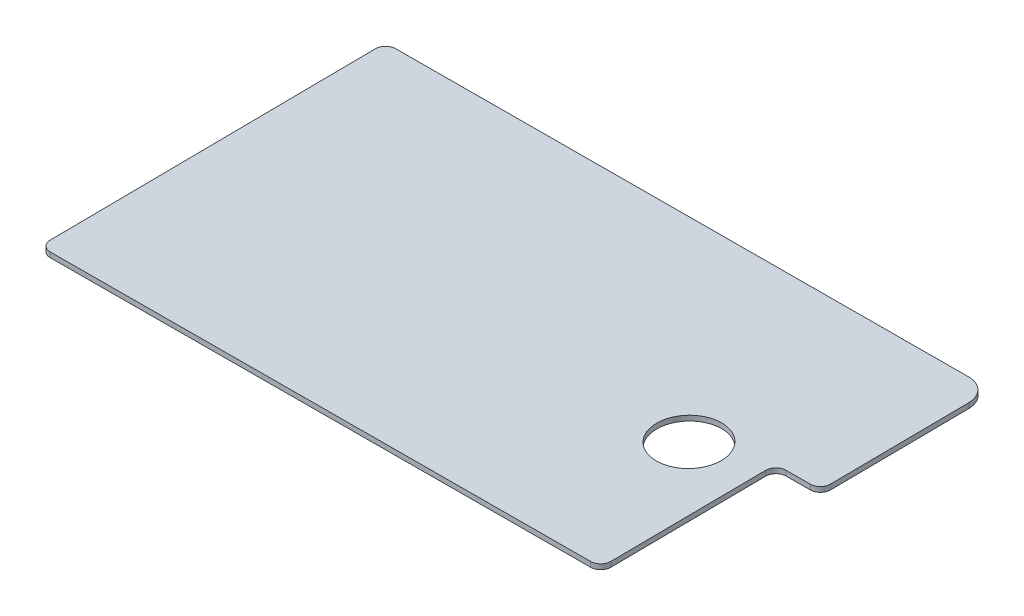
from build123d import *

# Parameters (mm, degrees)
BOSS_EXTRUDE1_DEPTH = 3.175
SKETCH4_R           = 20.32
CUT_EXTRUDE1_DEPTH  = 3.175


with BuildPart() as part:
    # Sketch1 → Boss-Extrude1 (new body)
    with BuildSketch(Plane(origin=(3.144869288, -1568.333107971, -7.514232815), x_dir=(0.9999919583187062, 0.004010352693004623, 1.921449190373677e-05), z_dir=(-0.004010352693004623, 0.9999460479318565, 0.009582186427904116))):
        with BuildLine():
            Line((253.440636473, 121.814232815), (-104.805130712, 121.814232815))
            ThreePointArc((-104.805130712, 121.814232815), (-109.295258773, 119.954360876), (-111.155130712, 115.464232815))
            Line((-111.155130712, 115.464232815), (-111.155130712, -87.735767185))
            ThreePointArc((-111.155130712, -87.735767185), (-109.295258773, -92.225895245), (-104.805130712, -94.085767185))
            Line((-104.805130712, -94.085767185), (233.014869288, -94.085767185))
            ThreePointArc((233.014869288, -94.085767185), (237.504997348, -92.225895245), (239.364869288, -87.735767185))
            Line((239.364869288, -87.735767185), (239.364869288, 8.89))
            ThreePointArc((239.364869288, 8.89), (241.224741227, 13.380128061), (245.714869288, 15.24))
            Line((245.714869288, 15.24), (260.954869288, 15.24))
            ThreePointArc((260.954869288, 15.24), (265.444997348, 17.099871939), (267.304869288, 21.59))
            Line((267.304869288, 21.59), (267.304869288, 107.95))
            ThreePointArc((267.304869288, 107.95), (263.244129512, 117.753493039), (253.440636473, 121.814232815))
        make_face()
    extrude(amount=BOSS_EXTRUDE1_DEPTH)

    # Sketch4 → Cut-Extrude1 (cut)
    with BuildSketch(Plane(origin=(3.157601814, -1568.332765376, -7.544655436), x_dir=(0.9999919583187062, 0.004010352693004624, 1.9214491903792285e-05), z_dir=(-0.004010352693004624, 0.9999460479318565, 0.009582186427904121))):
        with Locations(Location((199.747601441, 0.556803893, 0), (0, 0, 269.998899082))):
            Circle(SKETCH4_R)
    extrude(amount=CUT_EXTRUDE1_DEPTH, mode=Mode.SUBTRACT)


solid = part.part
